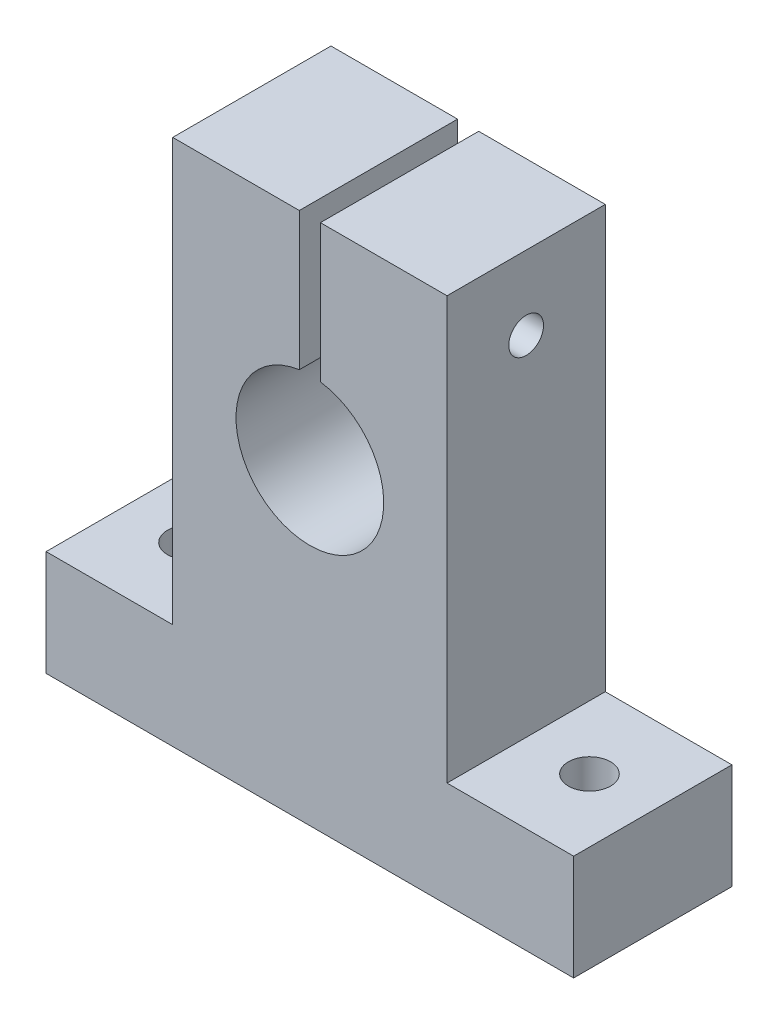
from build123d import *

# Parameters (mm, degrees)
BOSS_EXTRUDE1_DEPTH  = 15
SKETCH5_R            = 2
CUT_EXTRUDE3_DEPTH   = 15
D_GAGEMENT_M41_D     = 4.5
D_GAGEMENT_M41_DEPTH = 12
TROU_TARAUD_M41_D    = 3.3


with BuildPart() as part:
    # Sketch1 → Boss-Extrude1 (new body)
    with BuildSketch(Plane.XY):
        with BuildLine():
            Line((-26, 0), (-26, -40))
            Line((-26, -40), (-38, -40))
            Line((-38, -40), (-38, -50))
            Line((-38, -50), (12, -50))
            Line((12, -50), (12, -40))
            Line((12, -40), (0, -40))
            Line((0, -40), (0, 0))
            Line((0, 0), (-12, 0))
            Line((-12, 0), (-12, -13.07179677))
            ThreePointArc((-12, -13.07179677), (-13, -27), (-14, -13.07179677))
            Line((-14, -13.07179677), (-14, 0))
            Line((-14, 0), (-26, 0))
        make_face()
    extrude(amount=BOSS_EXTRUDE1_DEPTH)

    # Sketch5 → Cut-Extrude3 (cut)
    with BuildSketch(Plane(origin=(0, -40, 0), x_dir=(1, 0, 0), z_dir=(0, 1, 0))):
        with Locations(Location((6, -7.5, 0), (0, 0, 270))):
            Circle(SKETCH5_R)
        with Locations(Location((-32, -7.5, 0), (0, 0, 270))):
            Circle(SKETCH5_R)
    extrude(amount=-CUT_EXTRUDE3_DEPTH, mode=Mode.SUBTRACT)

    # Dégagement M41
    with Locations(Plane.ZY.offset(26)):
        with Locations((7.569852971, -7)):
            Hole(D_GAGEMENT_M41_D / 2, depth=D_GAGEMENT_M41_DEPTH)

    # Trou taraudé M41 (through all)
    with Locations(Plane(origin=(0, 0, 0), x_dir=(0, 0, -1), z_dir=(1, 0, 0))):
        with Locations((-7.5, -7)):
            Hole(TROU_TARAUD_M41_D / 2)


solid = part.part
